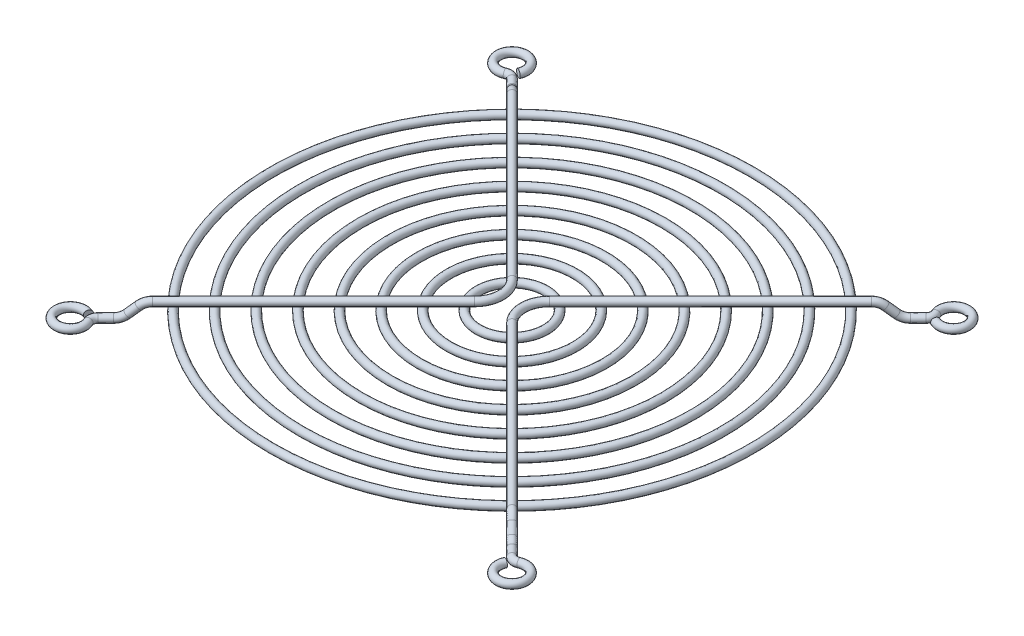
from build123d import *

# Parameters (mm, degrees)
SKETCH1_R               = 0.9
SKETCH3_R               = 0.9
SKETCH5_R               = 0.9
SKETCH7_R               = 0.9
CUT_EXTRUDE1_DEPTH      = 82.926369529
CUT_EXTRUDE1_DEPTH_BACK = 82.926369529
CIRPATTERN1_COUNT       = 4
SKETCH10_R              = 0.9
SKETCH12_R              = 0.9


with BuildPart() as part:
    # Sketch1 → Revolve1 (revolve)
    with BuildSketch(Plane.XY, mode=Mode.PRIVATE) as revolve1_sk:
        with Locations((-8, 2.8)):
            Circle(SKETCH1_R)
        with Locations((-56.9, 2.8)):
            Circle(SKETCH1_R)
        with Locations((-49.914285714, 2.8)):
            Circle(SKETCH1_R)
        with Locations((-42.928571429, 2.8)):
            Circle(SKETCH1_R)
        with Locations((-35.942857143, 2.8)):
            Circle(SKETCH1_R)
        with Locations((-28.957142857, 2.8)):
            Circle(SKETCH1_R)
        with Locations((-21.971428571, 2.8)):
            Circle(SKETCH1_R)
        with Locations((-14.985714286, 2.8)):
            Circle(SKETCH1_R)
    revolve(revolve1_sk.sketch.rotate(Axis((0, 2.8, 0), (0, -1, 0)), 270), axis=Axis((0, 2.8, 0), (0, -1, 0)))


with BuildPart() as body_2:
    # Sweep1: sweep along a path in Sketch2
    with BuildLine(Plane(origin=(0, 0, 0), x_dir=(1, 0, 0), z_dir=(0, 1, 0))) as sweep1_path:
        Line((-42.638538906, 42.638538906), (-4.438477631, 4.438477631))
        ThreePointArc((-4.438477631, 4.438477631), (-3.077804769, 2.402086785), (-2.6, 0))
    # Sketch3 → Sweep1 (sweep)
    with BuildSketch(Plane.XY):
        with Locations((-2.6, 4.6)):
            Circle(SKETCH3_R)
    sweep(path=sweep1_path.line)

    # Sweep2: sweep along a path in Sketch4
    with BuildLine(Plane(origin=(0, 0, 0), x_dir=(-0.7071067811865488, 0, -0.7071067811865464), z_dir=(0.7071067811865464, 0, -0.7071067811865488))) as sweep2_path:
        ThreePointArc((60.3, 4.6), (61.560050709, 4.372279972), (62.660690983, 3.717929006))
        Line((62.660690983, 3.717929006), (64.544099685, 2.082070994))
        ThreePointArc((64.544099685, 2.082070994), (65.644739959, 1.427720028), (66.904790668, 1.2))
    # Sketch5 → Sweep2 (sweep)
    with BuildSketch(Plane(origin=(-42.638538906, 0, -42.638538906), x_dir=(-0.7071067811865516, 0, 0.7071067811865435), z_dir=(-0.7071067811865435, 0, -0.7071067811865516))):
        with Locations((0, 4.6)):
            Circle(SKETCH5_R)
    sweep(path=sweep2_path.line)

    # Sweep3: sweep along a path in Sketch6
    with BuildLine(Plane(origin=(0, 0, 0), x_dir=(1, 0, 0), z_dir=(0, 1, 0))) as sweep3_path:
        Line((-47.308831175, 47.308831175), (-49.1015155, 49.1015155))
        ThreePointArc((-49.1015155, 49.1015155), (-50.044736365, 49.598294634), (-51.103556932, 49.474382908))
        ThreePointArc((-51.103556932, 49.474382908), (-54.63484643, 54.690297237), (-49.507029673, 51.032256351))
    # Sketch7 → Sweep3 (sweep)
    with BuildSketch(Plane(origin=(-47.308831175, 0, -47.308831175), x_dir=(-0.7071067811865515, 2.0261570199408882e-15, 0.7071067811865437), z_dir=(-0.7071067811865437, -2.0261570199409115e-15, -0.7071067811865515))):
        with Locations((0, 1.2)):
            Circle(SKETCH7_R)
    sweep(path=sweep3_path.line)

    # Sketch8 → Cut-Extrude1 (cut, two sides: drawn at the far end of the back side and taken through both)
    with BuildSketch(Plane(origin=(0, 0, 0), x_dir=(1, 0, 0), z_dir=(0, 1, 0)).offset(-CUT_EXTRUDE1_DEPTH_BACK)):
        Polygon((-136.629403968, -127.752448706), (-5.074873734, 3.802081528), (-3.802081528, 5.074873734), (127.752448706, 136.629403968), (390.861509173, -126.479656499), (126.479656499, -390.861509173), align=None)
    extrude(amount=CUT_EXTRUDE1_DEPTH + CUT_EXTRUDE1_DEPTH_BACK, mode=Mode.SUBTRACT)


with BuildPart() as cirpattern1_1:
    # CirPattern1: pattern copy
    add(body_2.part.rotate(Axis((0, 0, 0), (0, 1, 0)), 1 * 360 / CIRPATTERN1_COUNT))


with BuildPart() as cirpattern1_2:
    # CirPattern1: pattern copy
    add(body_2.part.rotate(Axis((0, 0, 0), (0, 1, 0)), 2 * 360 / CIRPATTERN1_COUNT))



with BuildPart() as cirpattern1_3:
    # CirPattern1: pattern copy
    add(body_2.part.rotate(Axis((0, 0, 0), (0, 1, 0)), 3 * 360 / CIRPATTERN1_COUNT))


with BuildPart() as body_2_1:
    add(body_2.part)

    add(cirpattern1_1.part)  # Sweep4 merges CirPattern1_1
    # Sweep4: sweep along a path in Sketch9
    with BuildLine(Plane(origin=(0, 0, 0), x_dir=(1, 0, 0), z_dir=(0, 1, 0))) as sweep4_path:
        ThreePointArc((-4.438477631, 4.438477631), (-2.6, 0), (-4.438477631, -4.438477631))
    # Sketch10 → Sweep4 (sweep)
    with BuildSketch(Plane(origin=(-4.438477631, 0, -4.438477631), x_dir=(0.7071067811865474, 0, -0.7071067811865477), z_dir=(0.7071067811865477, 0, 0.7071067811865474))):
        with Locations((0, 4.6)):
            Circle(SKETCH10_R)
    sweep(path=sweep4_path.line)


with BuildPart() as cirpattern1_2_1:
    add(cirpattern1_2.part)

    add(cirpattern1_3.part)  # Sweep5 merges CirPattern1_3
    # Sweep5: sweep along a path in Sketch11
    with BuildLine(Plane(origin=(0, 0, 0), x_dir=(1, 0, 0), z_dir=(0, 1, 0))) as sweep5_path:
        ThreePointArc((4.438477631, 4.438477631), (2.6, 0), (4.438477631, -4.438477631))
    # Sketch12 → Sweep5 (sweep)
    with BuildSketch(Plane(origin=(4.438477631, 0, -4.438477631), x_dir=(0.7071067811865551, 2.0443912222444393e-15, 0.7071067811865399), z_dir=(-0.7071067811865399, 2.044391222244483e-15, 0.7071067811865551))):
        with Locations((0, 4.6)):
            Circle(SKETCH12_R)
    sweep(path=sweep5_path.line)


solid = Compound([part.part, body_2_1.part, cirpattern1_2_1.part])
